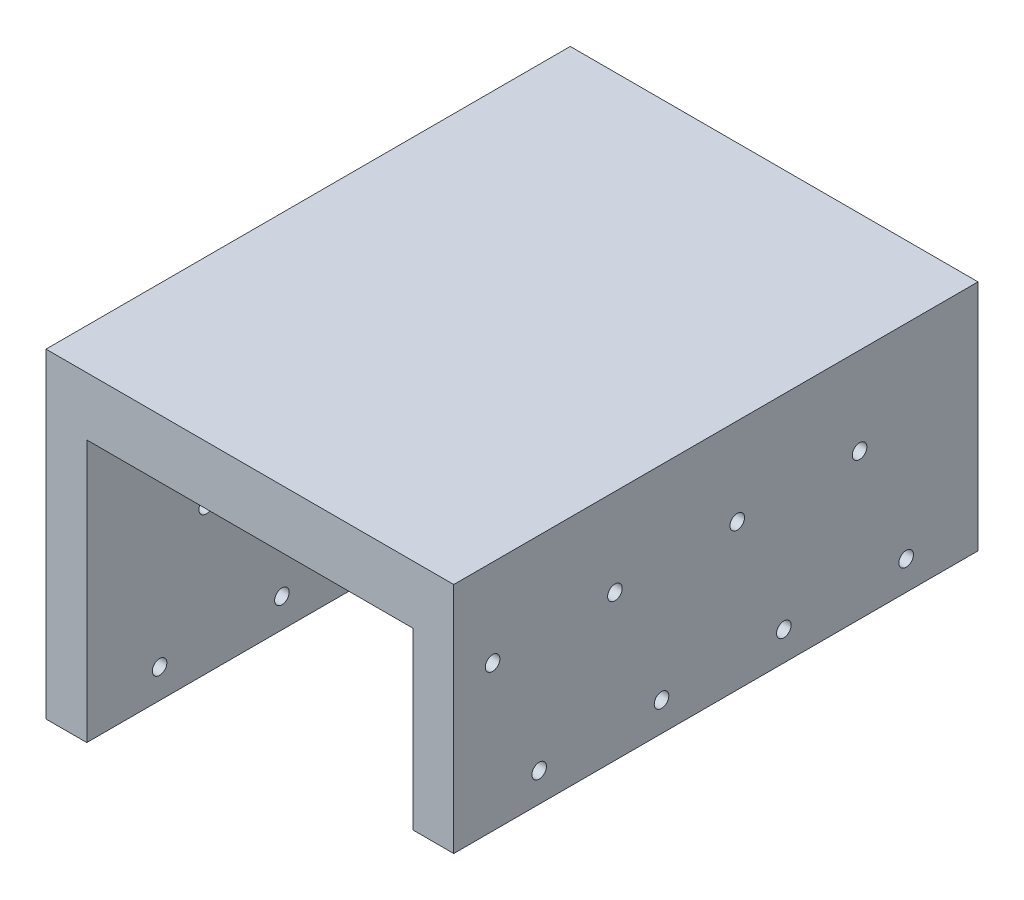
from build123d import *

# Parameters (mm, degrees)
SKETCH1_W               = 70
SKETCH1_H               = 55
BOSS_EXTRUDE1_DEPTH     = 90
CUT_EXTRUDE1_DEPTH      = 127.589889012
CUT_EXTRUDE1_DEPTH_BACK = 127.589889012
SKETCH3_R               = 1.25
CUT_EXTRUDE2_DEPTH      = 7
SKETCH4_R               = 1.25
CUT_EXTRUDE4_DEPTH      = 7


with BuildPart() as part:
    # Sketch1 → Boss-Extrude1 (new body)
    with BuildSketch(Plane.XY):
        with Locations((35, 27.5)):
            Rectangle(SKETCH1_W, SKETCH1_H)
    extrude(amount=BOSS_EXTRUDE1_DEPTH)

    # Sketch2 → Cut-Extrude1 (cut, two sides: drawn at the far end of the back side and taken through both)
    with BuildSketch(Plane.XY.offset(90).offset(-CUT_EXTRUDE1_DEPTH_BACK)):
        Polygon((7, 0), (7, 45), (63, 45), (63, 15), (70, 15), (70, 0), (60, 0), align=None)
    extrude(amount=CUT_EXTRUDE1_DEPTH + CUT_EXTRUDE1_DEPTH_BACK, mode=Mode.SUBTRACT)

    # Sketch3 → Cut-Extrude2 (cut)
    with BuildSketch(Plane.ZY):
        with Locations(Location((6.5, 25, 0), (0, 0, 270))):
            Circle(SKETCH3_R)
        with Locations(Location((14.5, 5, 0), (0, 0, 270))):
            Circle(SKETCH3_R)
        with Locations(Location((27.5, 25, 0), (0, 0, 270))):
            Circle(SKETCH3_R)
        with Locations(Location((35.5, 5, 0), (0, 0, 270))):
            Circle(SKETCH3_R)
        with Locations(Location((48.5, 25, 0), (0, 0, 270))):
            Circle(SKETCH3_R)
        with Locations(Location((56.5, 5, 0), (0, 0, 270))):
            Circle(SKETCH3_R)
        with Locations(Location((69.5, 25, 0), (0, 0, 270))):
            Circle(SKETCH3_R)
        with Locations(Location((77.5, 5, 0), (0, 0, 270))):
            Circle(SKETCH3_R)
    extrude(amount=-CUT_EXTRUDE2_DEPTH, mode=Mode.SUBTRACT)

    # Sketch4 → Cut-Extrude4 (cut)
    with BuildSketch(Plane(origin=(70, 0, 0), x_dir=(0, 0, -1), z_dir=(1, 0, 0))):
        with Locations(Location((-83.331764561, 40, 0), (0, 0, 90))):
            Circle(SKETCH4_R)
        with Locations(Location((-75.331764561, 20, 0), (0, 0, 90))):
            Circle(SKETCH4_R)
        with Locations(Location((-62.331764561, 40, 0), (0, 0, 90))):
            Circle(SKETCH4_R)
        with Locations(Location((-54.331764561, 20, 0), (0, 0, 90))):
            Circle(SKETCH4_R)
        with Locations(Location((-41.331764561, 40, 0), (0, 0, 90))):
            Circle(SKETCH4_R)
        with Locations(Location((-33.331764561, 20, 0), (0, 0, 90))):
            Circle(SKETCH4_R)
        with Locations(Location((-20.331764561, 40, 0), (0, 0, 90))):
            Circle(SKETCH4_R)
        with Locations(Location((-12.331764561, 20, 0), (0, 0, 90))):
            Circle(SKETCH4_R)
    extrude(amount=-CUT_EXTRUDE4_DEPTH, mode=Mode.SUBTRACT)


solid = part.part
